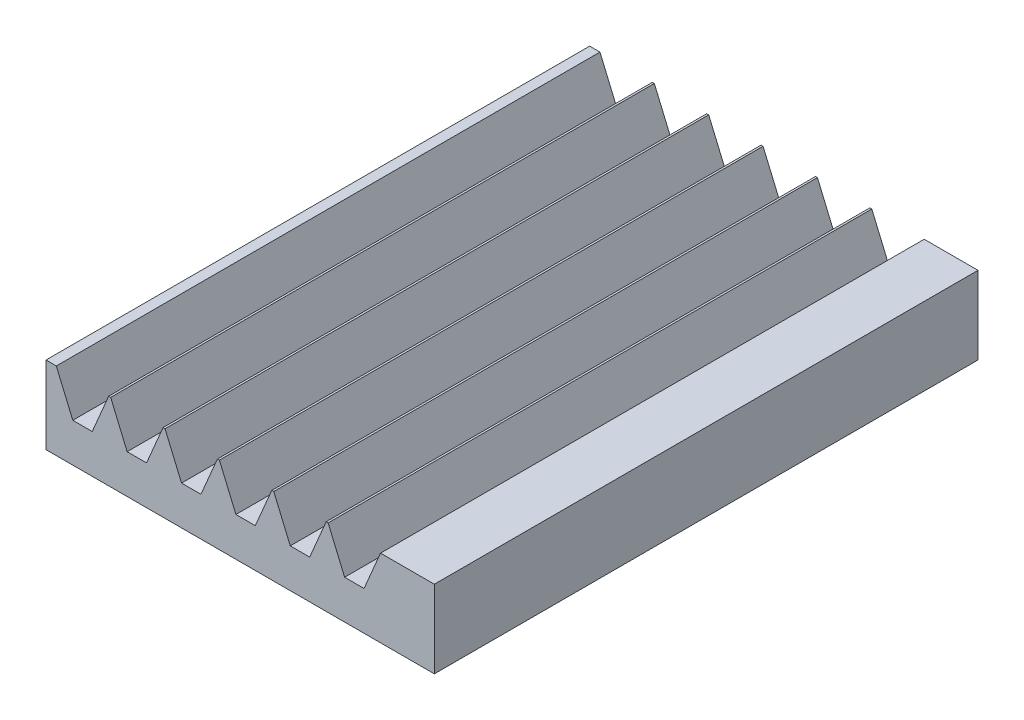
from build123d import *

# Parameters (mm, degrees)
BOSS_EXTRUDE1_DEPTH      = 5
BOSS_EXTRUDE1_DEPTH_BACK = 9
SKETCH1_W                = 10
SKETCH1_H                = 2
CUT_EXTRUDE1_DEPTH       = 18
LPATTERN2_COUNT          = 6
LPATTERN2_PITCH          = 1.4


with BuildPart() as part:
    # Sketch1 → Boss-Extrude1 (new, two sides: drawn at the far end of the back side and taken through both)
    with BuildSketch(Plane.XY.offset(-BOSS_EXTRUDE1_DEPTH_BACK)):
        with Locations((5, 1)):
            Rectangle(SKETCH1_W, SKETCH1_H)
    extrude(amount=BOSS_EXTRUDE1_DEPTH + BOSS_EXTRUDE1_DEPTH_BACK)

    # Sketch3 → Cut-Extrude1 (cut)
    with BuildSketch(Plane.XY.offset(5)):
        Polygon((0.689824634, 1), (1.189824634, 1), (1.619628875, 2.012555339), (0.260020392, 2.012555339), align=None)
    cut_extrude1 = extrude(amount=-CUT_EXTRUDE1_DEPTH, mode=Mode.SUBTRACT)

    # LPattern2: Cut-Extrude1 ×6
    with Locations(*[(i * LPATTERN2_PITCH, 0, 0) for i in range(1, LPATTERN2_COUNT)]):
        add(cut_extrude1, mode=Mode.SUBTRACT)


solid = part.part
